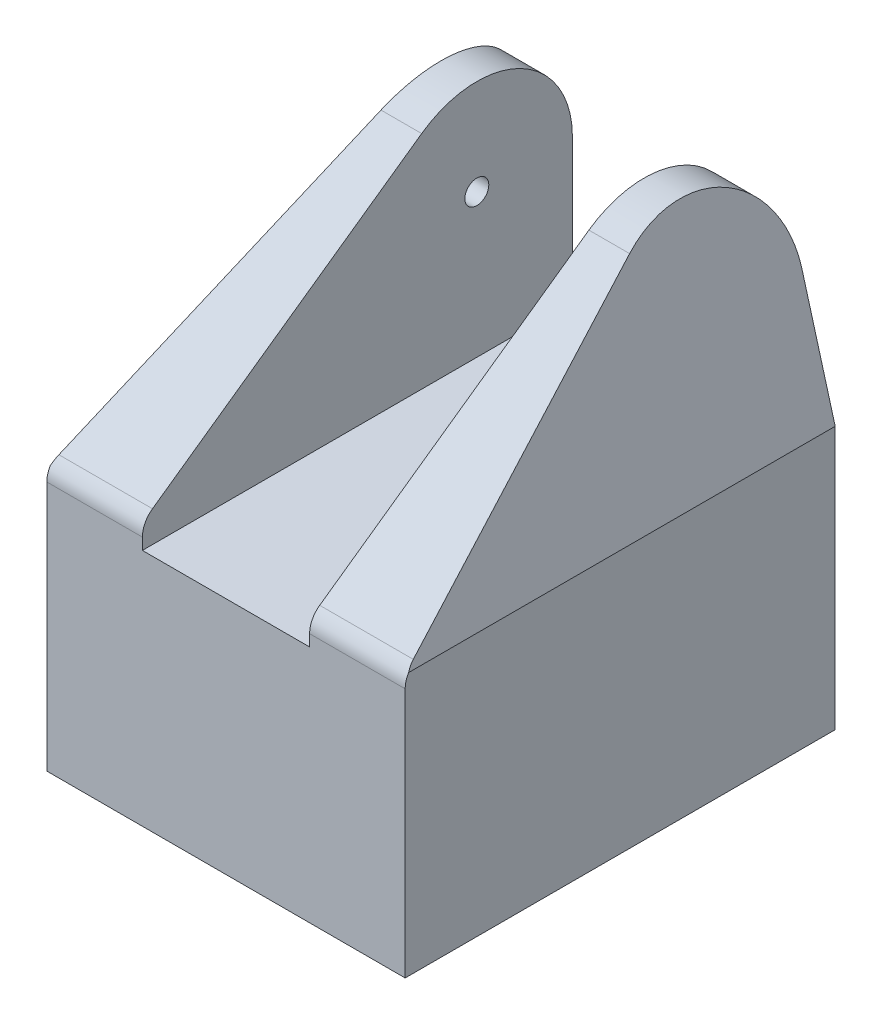
from build123d import *

# Parameters (mm, degrees)
EXTRUDE_1_DEPTH         = 150
FILLET_1_R              = 10
CUT_EXTRUDE_1_DEPTH     = 309.058436015
SKETCH1_R               = 12.5
CUT_EXTRUDE1_DEPTH      = 10
CUT_EXTRUDE2_DEPTH      = 80
CUT_EXTRUDE2_DEPTH_BACK = 10
SKETCH2_R               = 5


with BuildPart() as part:
    # 草圖1 → 填料-伸長1 (new body)
    with BuildSketch(Plane(origin=(0, 0, 0), x_dir=(0, 0, -1), z_dir=(1, 0, 0))):
        with BuildLine():
            Line((0, 0), (0, 160))
            ThreePointArc((0, 160), (-21.611444176, 195.522683101), (-63.093050736, 192.660542061))
            Line((-63.093050736, 192.660542061), (-180, 110))
            Line((-180, 110), (-180, 0))
            Line((-180, 0), (0, 0))
        make_face()
    extrude(amount=EXTRUDE_1_DEPTH)

    # 圓角1
    fillet_1_edges = [part.edges().sort_by_distance(p)[0] for p in [
        (75, 110, 180),
    ]]
    fillet(fillet_1_edges, radius=FILLET_1_R)

    # 草圖2 → 除料-伸長1 (cut, through all)
    with BuildSketch(Plane(origin=(0, 0, 0), x_dir=(-1, 0, 0), z_dir=(0, 0, -1))):
        Polygon((-150, 110), (-125, 200), (-125, 212.317241835), (-176.077029544, 212.317241835), (-176.077029544, 111.407234288), align=None)
        Polygon((-110, 110), (-110, 202.916849344), (-40, 202.916849344), (-40, 110), (-40, 100), (-110, 100), align=None)
        Polygon((26.077029544, 111.407234288), (0, 110), (-25, 200), (-25, 212.317241835), (26.077029544, 212.317241835), align=None)
    extrude(amount=-CUT_EXTRUDE_1_DEPTH, mode=Mode.SUBTRACT)

    # Sketch1 → Cut-Extrude1 (cut)
    with BuildSketch(Plane.XZ):
        with Locations(Location((75, 40, 0), (0, 0, 270))):
            Circle(SKETCH1_R)
    extrude(amount=-CUT_EXTRUDE1_DEPTH, mode=Mode.SUBTRACT)

    # Sketch2 → Cut-Extrude2 (cut, two sides: drawn at the far end of the back side and taken through both)
    with BuildSketch(Plane(origin=(40, 0, 0), x_dir=(0, 0, -1), z_dir=(1, 0, 0)).offset(-CUT_EXTRUDE2_DEPTH_BACK)):
        with Locations(Location((-40, 160, 0), (0, 0, 270))):
            Circle(SKETCH2_R)
    extrude(amount=CUT_EXTRUDE2_DEPTH + CUT_EXTRUDE2_DEPTH_BACK, mode=Mode.SUBTRACT)


solid = part.part
